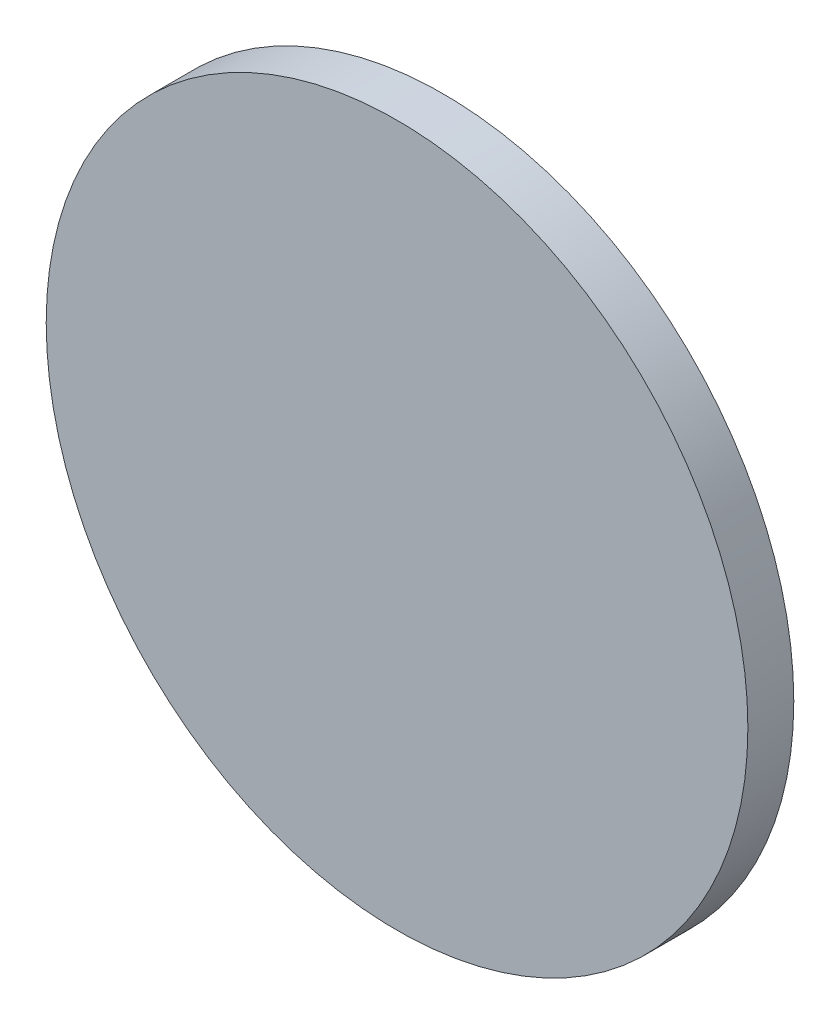
from build123d import *

# Parameters (mm, degrees)
SKETCH1_R           = 76.397015783
BOSS_EXTRUDE1_DEPTH = 10


with BuildPart() as part:
    # Sketch1 → Boss-Extrude1 (new body)
    with BuildSketch(Plane.XY):
        Circle(SKETCH1_R)
    extrude(amount=BOSS_EXTRUDE1_DEPTH)


solid = part.part
